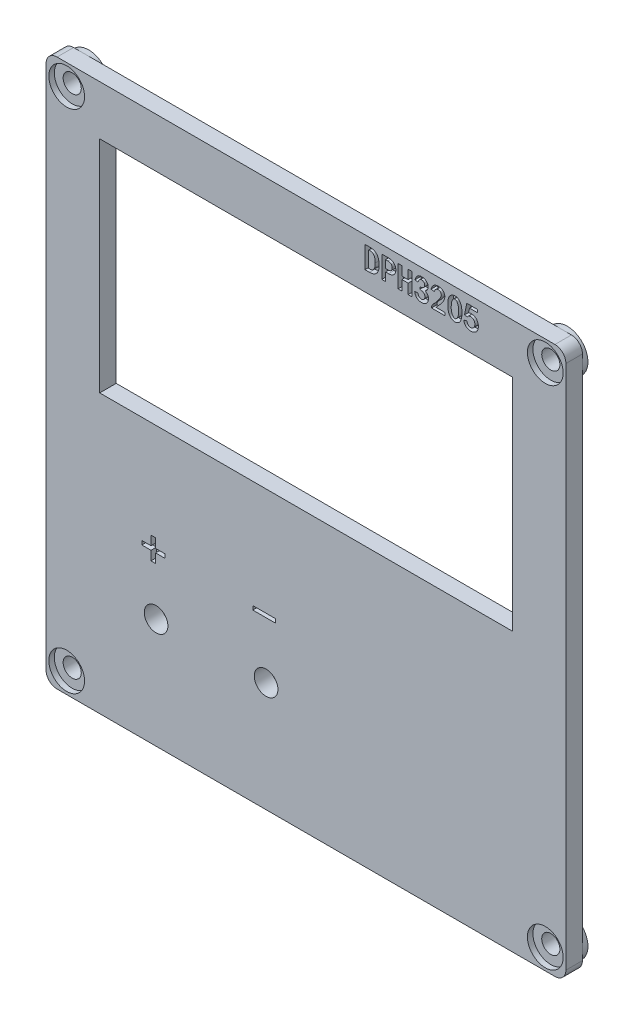
from build123d import *

# Parameters (mm, degrees)
SKETCH_1_R          = 2.15
SKETCH_1_W          = 75
SKETCH_1_H          = 40
EXTRUDE_1_DEPTH     = 3
SKETCH_2_W          = 4.137797811
SKETCH_2_H          = 0.710882164
CUT_EXTRUDE_1_DEPTH = 1
SKETCH_3_R          = 3.75
EXTRUDE_2_DEPTH     = 1
SKETCH_4_R          = 1.65
CUT_EXTRUDE_2_DEPTH = 69.72863319
SKETCH_5_R          = 3.25
CUT_EXTRUDE_3_DEPTH = 1


with BuildPart() as part:
    # 草图1 → 凸台-拉伸1 (new body)
    with BuildSketch(Plane.XY):
        with BuildLine():
            Line((-45.25, -49.75), (45.25, -49.75))
            ThreePointArc((45.25, -49.75), (46.664213562, -49.164213562), (47.25, -47.75))
            Line((47.25, -47.75), (47.25, 47.75))
            ThreePointArc((47.25, 47.75), (46.664213562, 49.164213562), (45.25, 49.75))
            Line((45.25, 49.75), (-45.25, 49.75))
            ThreePointArc((-45.25, 49.75), (-46.664213562, 49.164213562), (-47.25, 47.75))
            Line((-47.25, 47.75), (-47.25, -47.75))
            ThreePointArc((-47.25, -47.75), (-46.664213562, -49.164213562), (-45.25, -49.75))
        make_face()
        with Locations((-27.25, -29.75)):
            Circle(SKETCH_1_R, mode=Mode.SUBTRACT)
        with Locations((-7.25, -29.75)):
            Circle(SKETCH_1_R, mode=Mode.SUBTRACT)
        with Locations((0, 20.75)):
            Rectangle(SKETCH_1_W, SKETCH_1_H, mode=Mode.SUBTRACT)
    extrude(amount=EXTRUDE_1_DEPTH)

    # 草图2 → 切除-拉伸1 (cut)
    # profile 1 of 9: a face of its own
    with BuildSketch(Plane.XY.offset(3)):
        with BuildLine():
            add(Edge.make_bspline(
                [(25.773758367, 46.505328525), (25.775969709, 46.555147397), (25.78028274, 46.652314757), (25.792643094, 46.793720271), (25.807811887, 46.927506481), (25.827234123, 47.053324063), (25.851527714, 47.171241352), (25.878621466, 47.281438374), (25.910258204, 47.383865297), (25.958071695, 47.508706729), (26.028073633, 47.65355075), (26.129838409, 47.812915081), (26.249373739, 47.956068284), (26.361427404, 48.062917846), (26.459859694, 48.137856014), (26.539050196, 48.187020162), (26.623405238, 48.228229653), (26.712377362, 48.261567945), (26.805561652, 48.288572609), (26.903860095, 48.307274167), (27.006946072, 48.318309436), (27.113386993, 48.321492741), (27.220523142, 48.317648244), (27.325149694, 48.299647225), (27.426333108, 48.272415435), (27.523724912, 48.23356352), (27.617020335, 48.183418171), (27.705974966, 48.121730736), (27.791206089, 48.049115977), (27.872032503, 47.966443402), (27.946529479, 47.875359078), (28.017067085, 47.780694437), (28.077305495, 47.679174353), (28.133000891, 47.574821135), (28.179768948, 47.464746766), (28.221878796, 47.35086003), (28.253542284, 47.230979038), (28.289719702, 47.063498275), (28.319887216, 46.841890265), (28.342221295, 46.562137879), (28.348624342, 46.264320492), (28.340737918, 46.006845206), (28.326531135, 45.798207482), (28.310482089, 45.646366882), (28.288556953, 45.501864688), (28.263873867, 45.363943398), (28.230439156, 45.23364898), (28.193993631, 45.10964595), (28.152076056, 44.992861191), (28.104678237, 44.883230969), (28.05213051, 44.780496547), (27.990371895, 44.686222656), (27.921958927, 44.599748852), (27.846666976, 44.520638651), (27.763766457, 44.449935675), (27.673294119, 44.387250387), (27.575816856, 44.332224167), (27.472861073, 44.285167849), (27.36614023, 44.248577337), (27.258979427, 44.222399489), (27.152163404, 44.208670953), (27.045937061, 44.20572628), (26.940309689, 44.215496424), (26.835177704, 44.2361569), (26.731193601, 44.269237737), (26.629037036, 44.312736289), (26.531987609, 44.365043186), (26.440383588, 44.420585111), (26.356701959, 44.480730209), (26.28118794, 44.545618287), (26.211755205, 44.612929848), (26.151672362, 44.686044277), (26.097640965, 44.762044244), (26.039569231, 44.870531569), (25.976248246, 45.009582451), (25.912056748, 45.180745354), (25.85808123, 45.35509476), (25.824800149, 45.504726549), (25.802464788, 45.629516835), (25.790263573, 45.731610409), (25.779644583, 45.841503623), (25.773230384, 45.959230052), (25.768976816, 46.08460339), (25.767102405, 46.217713298), (25.769107518, 46.358830641), (25.772177634, 46.455536739), (25.773758367, 46.505328525)],
                knots=[0, 0, 0, 0, 1.155683737, 2.254060208, 3.289083543, 4.275996313, 5.203501349, 6.078654409, 6.905254226, 7.686259293, 9.175480835, 10.625362805, 12.057229327, 13.488373587, 14.203415217, 14.921281653, 15.645099004, 16.375632236, 17.120922195, 17.891035316, 18.691651653, 19.521200253, 20.357904477, 21.171386448, 21.975949703, 22.782724614, 23.595854961, 24.425642192, 25.286833663, 26.187407587, 27.101221321, 28.01267284, 28.920448357, 29.83426209, 30.752254981, 31.690137756, 32.645956503, 33.622989927, 35.660431351, 37.823041574, 40.125301952, 42.560703798, 43.790833543, 44.971618186, 46.098231705, 47.178004829, 48.217249088, 49.214075701, 50.172927633, 51.090920525, 51.980953586, 52.843803822, 53.698431003, 54.533503556, 55.370943622, 56.21918914, 57.080584939, 57.962199368, 58.839009869, 59.691678548, 60.51441043, 61.330511274, 62.149625556, 62.967853103, 63.80909348, 64.673955469, 65.537417366, 66.362178841, 67.155619074, 67.922554923, 68.668316995, 69.393591698, 70.113049857, 70.825595159, 72.241347001, 73.651946307, 75.059845092, 76.467821999, 77.201720101, 77.997292311, 78.850038385, 79.760306499, 80.729291287, 81.757490875, 82.845382708, 84, 84, 84, 84], degree=3))
        make_face()
        with BuildLine():
            add(Edge.make_bspline(
                [(26.41509771, 46.636687186), (26.410165106, 46.585487328), (26.400476242, 46.484918041), (26.392201304, 46.33572282), (26.387876527, 46.19080666), (26.392312663, 46.050219507), (26.398966837, 45.913761834), (26.414043524, 45.782047153), (26.433830158, 45.654311536), (26.458059753, 45.531807031), (26.488276758, 45.416206016), (26.521468133, 45.309323189), (26.557380799, 45.211249156), (26.59736876, 45.123027902), (26.641451804, 45.044114897), (26.688547916, 44.97459924), (26.738281787, 44.913312011), (26.792544689, 44.862927743), (26.848364897, 44.821316698), (26.905215929, 44.789259165), (26.962359574, 44.766437831), (27.019979655, 44.753170966), (27.078314302, 44.749657478), (27.136986281, 44.756149113), (27.196285597, 44.770529558), (27.254563841, 44.796176626), (27.311436858, 44.829485722), (27.366424787, 44.869793435), (27.415834334, 44.919582698), (27.46269417, 44.97568869), (27.50553198, 45.039712753), (27.544919173, 45.11091034), (27.580297618, 45.189959669), (27.622276756, 45.306268798), (27.665555628, 45.4617722), (27.703450078, 45.656969482), (27.725582549, 45.861453971), (27.731834948, 46.071718898), (27.729599297, 46.281590487), (27.722491719, 46.484800812), (27.712611199, 46.678373121), (27.697920649, 46.862437574), (27.674674905, 47.037543403), (27.634162425, 47.202873635), (27.577482221, 47.3577924), (27.517488775, 47.478120074), (27.462791153, 47.56536967), (27.419765216, 47.623154318), (27.37345661, 47.671545013), (27.325938432, 47.713322683), (27.275020824, 47.745046871), (27.221804213, 47.768627401), (27.166358108, 47.784438549), (27.108992325, 47.791110861), (27.051120902, 47.789457516), (26.994094684, 47.77906452), (26.938124506, 47.759887967), (26.883859036, 47.730891663), (26.830409045, 47.693569323), (26.77795796, 47.647879341), (26.727069625, 47.592989371), (26.677356181, 47.529473969), (26.629533656, 47.456150099), (26.587202958, 47.371127633), (26.547238137, 47.275897154), (26.514222271, 47.168769499), (26.48132146, 47.051798414), (26.456054589, 46.922991706), (26.432189797, 46.783682654), (26.42092889, 46.686836533), (26.41509771, 46.636687186)],
                knots=[0, 0, 0, 0, 1.452167118, 2.852418281, 4.218396657, 5.543984443, 6.822765002, 8.074713207, 9.284974616, 10.471920825, 11.598846593, 12.656922723, 13.631044256, 14.5458853, 15.388812111, 16.179953707, 16.914519434, 17.61197034, 18.264888641, 18.876285569, 19.449485096, 19.996394829, 20.5387489, 21.091123116, 21.657504393, 22.254856762, 22.881287043, 23.51641241, 24.173517405, 24.856351225, 25.578003657, 26.344795291, 27.151303469, 28.020468383, 29.834110771, 31.702512638, 33.62906866, 35.634339229, 37.638355807, 39.554512999, 41.375197988, 43.110520322, 44.767505055, 46.356911141, 47.906083104, 49.416608493, 50.142950543, 50.812019548, 51.446476334, 52.031067659, 52.593805832, 53.132839029, 53.670052187, 54.215287947, 54.756919201, 55.298972215, 55.845822252, 56.420500712, 57.030186539, 57.683154838, 58.380605745, 59.14033988, 59.958423015, 60.847419337, 61.818318184, 62.871135914, 64.010020701, 65.247701822, 66.574791078, 68, 68, 68, 68], degree=3))
        make_face(mode=Mode.SUBTRACT)
    # profile 2 of 9: a face of its own
    with BuildSketch(Plane.XY.offset(3)):
        with BuildLine():
            add(Edge.make_bspline(
                [(13.285241518, 46.240035544), (13.283682115, 46.155285074), (13.280668639, 45.991508663), (13.259812953, 45.754935684), (13.22273555, 45.536896219), (13.173073162, 45.336448602), (13.106910902, 45.154244072), (13.026293325, 44.99020749), (12.931485953, 44.843811701), (12.820659608, 44.716773682), (12.696286472, 44.607755406), (12.563161093, 44.51142845), (12.418082939, 44.431513034), (12.263072893, 44.364668391), (12.096315889, 44.314857921), (11.919536629, 44.27743285), (11.731770227, 44.25631633), (11.603099923, 44.25321417), (11.537226923, 44.251626014)],
                knots=[0, 0, 0, 0, 1.342144575, 2.593633054, 3.756717374, 4.841651051, 5.859627, 6.82036316, 7.730462365, 8.613865072, 9.480661094, 10.344703869, 11.211025818, 12.098326216, 13.012995588, 13.962311034, 14.956801371, 16, 16, 16, 16], degree=3))
            Line((11.537226923, 44.251626014), (10.708722952, 44.251626014))
            Line((10.708722952, 44.251626014), (10.708722952, 48.251626014))
            Line((10.708722952, 48.251626014), (11.537226923, 48.251626014))
            add(Edge.make_bspline(
                [(11.537226923, 48.251626014), (11.610260238, 48.250152136), (11.751820851, 48.247295317), (11.956676316, 48.225090944), (12.146366, 48.187602682), (12.320852916, 48.135495871), (12.480414228, 48.068439758), (12.624969787, 47.985881101), (12.753924652, 47.887279685), (12.867888749, 47.773205371), (12.967800644, 47.642938015), (13.052548693, 47.494253787), (13.12560502, 47.328943544), (13.184776317, 47.145345933), (13.229402626, 46.944031425), (13.26162354, 46.725110145), (13.281461748, 46.48852175), (13.283952355, 46.324786503), (13.285241518, 46.240035544)],
                knots=[0, 0, 0, 0, 1.139218849, 2.20815003, 3.209846182, 4.151949686, 5.044228713, 5.904257272, 6.741881979, 7.569029454, 8.412913495, 9.295104618, 10.232584117, 11.227981957, 12.299195142, 13.445861256, 14.677952907, 16, 16, 16, 16], degree=3))
        make_face()
        with BuildLine():
            add(Edge.make_bspline(
                [(12.574359354, 46.240035544), (12.573549734, 46.306164867), (12.57199564, 46.433102252), (12.559864164, 46.615622808), (12.540805925, 46.782578834), (12.512892596, 46.934201333), (12.476157586, 47.070344041), (12.4320268, 47.191100107), (12.379864709, 47.296547246), (12.318068244, 47.38635609), (12.247965414, 47.46285518), (12.171239802, 47.529860091), (12.08537177, 47.586000977), (11.991202509, 47.631481211), (11.88917519, 47.666818632), (11.779119259, 47.691264389), (11.66103836, 47.707233513), (11.579351112, 47.708978836), (11.537226923, 47.709878858)],
                knots=[0, 0, 0, 0, 1.535002912, 2.946487986, 4.244348877, 5.43397676, 6.521824758, 7.513996585, 8.414230777, 9.245329631, 10.035428857, 10.817273383, 11.604069902, 12.409274804, 13.239177928, 14.104616871, 15.02259556, 16, 16, 16, 16], degree=3))
            Line((11.537226923, 47.709878858), (11.396424175, 47.709878858))
            Line((11.396424175, 47.709878858), (11.396424175, 44.79337317))
            Line((11.396424175, 44.79337317), (11.537226923, 44.79337317))
            add(Edge.make_bspline(
                [(11.537226923, 44.79337317), (11.579344288, 44.794347045), (11.66098203, 44.796234747), (11.779335594, 44.811216162), (11.889744031, 44.834562761), (11.99159878, 44.869176125), (12.085536319, 44.913032061), (12.17094767, 44.967647772), (12.248752448, 45.031374777), (12.318834537, 45.105681961), (12.380934193, 45.193019115), (12.432859029, 45.296288209), (12.476092639, 45.41526561), (12.513071508, 45.549530777), (12.540773279, 45.700073783), (12.559878509, 45.86615988), (12.571993635, 46.047827474), (12.573548952, 46.174192627), (12.574359354, 46.240035544)],
                knots=[0, 0, 0, 0, 0.985268004, 1.909783609, 2.787259994, 3.621665962, 4.421521346, 5.207376589, 5.987676396, 6.769383106, 7.590706022, 8.48624322, 9.465232296, 10.548914331, 11.741531606, 13.043184133, 14.459342799, 16, 16, 16, 16], degree=3))
        make_face(mode=Mode.SUBTRACT)
    # profile 3 of 9: a face of its own
    with BuildSketch(Plane.XY.offset(3)):
        with BuildLine():
            add(Edge.make_bspline(
                [(16.329671653, 47.013592101), (16.328806119, 46.968605593), (16.327107643, 46.880326519), (16.310133088, 46.751375346), (16.284075298, 46.628724295), (16.246005839, 46.513164938), (16.197560034, 46.404236552), (16.139240793, 46.301371071), (16.06887224, 46.205508952), (15.988432171, 46.116506701), (15.898521193, 46.035598708), (15.798916655, 45.965374644), (15.68972746, 45.906889173), (15.571635008, 45.858986945), (15.444923381, 45.8209571), (15.309138478, 45.794921736), (15.164754445, 45.778066366), (15.065358552, 45.77640862), (15.01436794, 45.775558188)],
                knots=[0, 0, 0, 0, 1.055941234, 2.072121589, 3.048957332, 3.996857081, 4.923552649, 5.844699312, 6.768221172, 7.710385292, 8.657546142, 9.602916946, 10.565193964, 11.559900134, 12.591170482, 13.666713964, 14.803012066, 16, 16, 16, 16], degree=3))
            Line((15.01436794, 45.775558188), (14.464035251, 45.775558188))
            Line((14.464035251, 45.775558188), (14.464035251, 44.251626014))
            Line((14.464035251, 44.251626014), (13.776334027, 44.251626014))
            Line((13.776334027, 44.251626014), (13.776334027, 48.251626014))
            Line((13.776334027, 48.251626014), (15.01436794, 48.251626014))
            add(Edge.make_bspline(
                [(15.01436794, 48.251626014), (15.065358459, 48.250775176), (15.164754169, 48.24911664), (15.309139492, 48.232266867), (15.444919861, 48.206211821), (15.571393321, 48.16832709), (15.689323223, 48.120264803), (15.797824013, 48.060813767), (15.897699579, 47.990787048), (15.987547151, 47.909793342), (16.068081752, 47.820858618), (16.138225908, 47.724699681), (16.197735386, 47.622354254), (16.245939904, 47.513123531), (16.284100665, 47.397612587), (16.310039712, 47.275221892), (16.327161825, 47.146580039), (16.3288226, 47.058580774), (16.329671653, 47.013592101)],
                knots=[0, 0, 0, 0, 1.197461093, 2.334208364, 3.410176999, 4.441854999, 5.43073401, 6.396602736, 7.342347237, 8.289882492, 9.232419041, 10.156305961, 11.081170954, 12.008232837, 12.956507283, 13.93372916, 14.943641362, 16, 16, 16, 16], degree=3))
        make_face()
        with BuildLine():
            add(Edge.make_bspline(
                [(15.64197043, 47.013592101), (15.64167773, 47.045959339), (15.641114234, 47.108271506), (15.631250111, 47.197481465), (15.616825916, 47.278714862), (15.597665845, 47.352440408), (15.571114529, 47.417980744), (15.538387259, 47.475120916), (15.50023693, 47.524371351), (15.455388593, 47.565178288), (15.40481494, 47.600096416), (15.347417164, 47.628677232), (15.284866641, 47.654842386), (15.215494445, 47.675363293), (15.139850619, 47.690364977), (15.058129368, 47.701417981), (14.970127036, 47.708352746), (14.909351534, 47.709357961), (14.877857959, 47.709878858)],
                knots=[0, 0, 0, 0, 1.287087184, 2.477851002, 3.56551051, 4.568137571, 5.502703185, 6.369845782, 7.180743627, 7.970419851, 8.772637866, 9.617977299, 10.516617182, 11.467615524, 12.490341929, 13.582105939, 14.747058877, 16, 16, 16, 16], degree=3))
            Line((14.877857959, 47.709878858), (14.464035251, 47.709878858))
            Line((14.464035251, 47.709878858), (14.464035251, 46.318163897))
            Line((14.464035251, 46.318163897), (14.877857959, 46.318163897))
            add(Edge.make_bspline(
                [(14.877857959, 46.318163897), (14.909350441, 46.318695819), (14.970409155, 46.319727126), (15.058709899, 46.3265609), (15.140696737, 46.337710851), (15.21639406, 46.352580653), (15.285484277, 46.373499153), (15.348313312, 46.398061846), (15.40494137, 46.427407508), (15.455410119, 46.461960691), (15.500231043, 46.502825219), (15.538388973, 46.552059685), (15.571114017, 46.609204533), (15.597665998, 46.674743473), (15.61682587, 46.748469436), (15.631250125, 46.829702708), (15.64111423, 46.918912704), (15.641677728, 46.981224866), (15.64197043, 47.013592101)],
                knots=[0, 0, 0, 0, 1.253177668, 2.4297043, 3.521674426, 4.544593913, 5.495771796, 6.390314524, 7.225705931, 8.028075398, 8.817900706, 9.628951643, 10.496257949, 11.431000001, 12.433816351, 13.5216812, 14.712669824, 16, 16, 16, 16], degree=3))
        make_face(mode=Mode.SUBTRACT)
    # profile 4 of 9: a face of its own
    with BuildSketch(Plane.XY.offset(3)):
        Polygon((19.260772748, 44.251626014), (18.573071524, 44.251626014), (18.573071524, 46.07175909), (17.440639672, 46.07175909), (17.440639672, 44.251626014), (16.752938449, 44.251626014), (16.752938449, 48.251626014), (17.440639672, 48.251626014), (17.440639672, 46.613506246), (18.573071524, 46.613506246), (18.573071524, 48.251626014), (19.260772748, 48.251626014), align=None)
    # profile 5 of 9: a face of its own
    with BuildSketch(Plane.XY.offset(3)):
        with BuildLine():
            Line((19.751865257, 45.352291393), (20.303915053, 45.430419746))
            add(Edge.make_bspline(
                [(20.303915053, 45.430419746), (20.322527897, 45.376460329), (20.357887277, 45.273952002), (20.426144056, 45.133940589), (20.503365858, 45.015634424), (20.575355936, 44.931661448), (20.638782126, 44.877911171), (20.687663423, 44.84326029), (20.739493325, 44.814707903), (20.794065521, 44.792432205), (20.851246549, 44.775092948), (20.911027357, 44.763102805), (20.973732907, 44.757073049), (21.037815362, 44.75726895), (21.102064811, 44.762785539), (21.164109097, 44.776071041), (21.223704826, 44.794546264), (21.279697156, 44.820709477), (21.33275333, 44.852822425), (21.382775849, 44.891533337), (21.429027941, 44.937652945), (21.472498497, 44.988700856), (21.51171804, 45.044064122), (21.54541632, 45.102277643), (21.572000201, 45.163263993), (21.593649768, 45.2257636), (21.60910437, 45.290469168), (21.618573836, 45.356861999), (21.621930306, 45.425250114), (21.619382033, 45.49476754), (21.610881373, 45.563391392), (21.597247592, 45.628923734), (21.578360894, 45.690593788), (21.553549558, 45.74831901), (21.522212256, 45.802064303), (21.485296973, 45.851831342), (21.4429354, 45.897532753), (21.394923886, 45.939749217), (21.338639819, 45.977614843), (21.274167091, 46.014175221), (21.198779264, 46.045817155), (21.114860117, 46.077189382), (21.020825599, 46.104085407), (20.917696519, 46.128905767), (20.804852417, 46.151317002), (20.72608998, 46.163365679), (20.685112735, 46.16963417)],
                knots=[0, 0, 0, 0, 2.21924101, 4.215958907, 6.040992817, 7.7053072, 8.495104242, 9.27040691, 10.032811151, 10.791629887, 11.559461714, 12.354265444, 13.159682002, 14.005854253, 14.844521828, 15.663370554, 16.46971005, 17.266772081, 18.061107775, 18.878441235, 19.720869505, 20.597620065, 21.484212586, 22.356995289, 23.209370964, 24.068482601, 24.927233434, 25.793243368, 26.673943911, 27.587530034, 28.496218265, 29.360938961, 30.188521517, 31.001368487, 31.799596098, 32.603472073, 33.407116705, 34.21988742, 35.084608115, 36.041665591, 37.098677481, 38.261085067, 39.525891865, 40.900414571, 42.387397877, 44, 44, 44, 44], degree=3))
            Line((20.685112735, 46.16963417), (20.685112735, 46.562851599))
            add(Edge.make_bspline(
                [(20.685112735, 46.562851599), (20.725812533, 46.566951134), (20.804345719, 46.574861483), (20.916916171, 46.594044211), (21.020171393, 46.616955759), (21.113855562, 46.644024174), (21.197941264, 46.676026146), (21.272699478, 46.711579511), (21.338296413, 46.751930391), (21.393327612, 46.798257558), (21.441591196, 46.847206094), (21.480534653, 46.901225645), (21.515224357, 46.957060153), (21.540391325, 47.017565156), (21.559798937, 47.08106698), (21.571489359, 47.147955425), (21.576667948, 47.218421336), (21.57470773, 47.290830965), (21.566948359, 47.362948577), (21.55007106, 47.430948714), (21.528284025, 47.494545431), (21.497753116, 47.55240176), (21.460574356, 47.605243257), (21.416324173, 47.653163772), (21.364425562, 47.694916823), (21.307089514, 47.731659985), (21.246309478, 47.762096153), (21.183795552, 47.785397606), (21.121233185, 47.802352932), (21.057641364, 47.809699831), (20.994085545, 47.810520265), (20.92965385, 47.804959816), (20.865475333, 47.789427564), (20.800038032, 47.768838572), (20.735804957, 47.735465955), (20.67276126, 47.689076343), (20.613477454, 47.627298757), (20.555378599, 47.552476926), (20.500361872, 47.463653434), (20.445795024, 47.361451425), (20.393945616, 47.245129984), (20.362965719, 47.161736455), (20.34684272, 47.118335608)],
                knots=[0, 0, 0, 0, 1.544655138, 2.980523068, 4.310085624, 5.538041238, 6.660247671, 7.704521267, 8.661264608, 9.559490368, 10.415691744, 11.250192615, 12.06957472, 12.892798034, 13.716943409, 14.573554092, 15.451518492, 16.381382685, 17.306522728, 18.184819779, 19.022465106, 19.839562419, 20.646298093, 21.457079029, 22.294445327, 23.155002605, 24.02514668, 24.85635064, 25.671730158, 26.466794538, 27.266766995, 28.070237254, 28.901511498, 29.756073687, 30.655274543, 31.621678213, 32.699429876, 33.87785843, 35.19439462, 36.640317884, 38.251506453, 40, 40, 40, 40], degree=3))
            Line((20.34684272, 47.118335608), (19.797368584, 47.196463962))
            add(Edge.make_bspline(
                [(19.797368584, 47.196463962), (19.809239482, 47.235816237), (19.832566992, 47.313147415), (19.874227902, 47.424250762), (19.917812171, 47.529602096), (19.965103325, 47.628469239), (20.015638403, 47.721458083), (20.06997827, 47.808003584), (20.126165903, 47.889441874), (20.187759361, 47.963403573), (20.252665616, 48.03205765), (20.324427508, 48.092427734), (20.402334197, 48.144965642), (20.485631487, 48.190512521), (20.574717933, 48.228616914), (20.669755236, 48.258331904), (20.770432139, 48.281800881), (20.875918338, 48.296474854), (20.982580733, 48.3051184), (21.087809443, 48.30663585), (21.190210064, 48.302706107), (21.28977884, 48.291550541), (21.386256282, 48.273662), (21.479338715, 48.248344895), (21.569889341, 48.217593356), (21.656949772, 48.180117772), (21.738895303, 48.136477806), (21.815187368, 48.088252857), (21.884655518, 48.035034111), (21.947965698, 47.977345495), (22.004028953, 47.914312176), (22.053320914, 47.846180064), (22.095135635, 47.772753509), (22.131419489, 47.695640996), (22.16003099, 47.61527674), (22.183194708, 47.533088783), (22.196972044, 47.448684641), (22.206256304, 47.362969551), (22.206607991, 47.275344026), (22.200743541, 47.186370711), (22.18739375, 47.095487764), (22.168388673, 47.00362617), (22.140317229, 46.912388801), (22.101650354, 46.824222569), (22.051284759, 46.740649056), (21.990529759, 46.661189674), (21.91963906, 46.585446861), (21.838673163, 46.513276581), (21.747011889, 46.444900285), (21.680250055, 46.4043288), (21.64583392, 46.383413951)],
                knots=[0, 0, 0, 0, 1.264664845, 2.485193632, 3.649815651, 4.772554787, 5.8564488, 6.904873161, 7.916470085, 8.89869285, 9.86418825, 10.820480558, 11.778069864, 12.751606364, 13.738084608, 14.754768136, 15.81232734, 16.915902724, 18.029136064, 19.103794268, 20.152810375, 21.180875043, 22.184503936, 23.16940822, 24.147039655, 25.125424593, 26.08285187, 27.001536872, 27.899944066, 28.772641487, 29.633525806, 30.491521848, 31.355643938, 32.230383382, 33.110780052, 33.97826197, 34.85428633, 35.739428161, 36.629028292, 37.54707979, 38.481255219, 39.453795203, 40.431585318, 41.413492129, 42.408894417, 43.427064688, 44.486456052, 45.596758908, 46.761114469, 48, 48, 48, 48], degree=3))
            add(Edge.make_bspline(
                [(21.64583392, 46.383413951), (21.670582827, 46.373146404), (21.719451451, 46.35287234), (21.789976856, 46.317014014), (21.854754808, 46.273243025), (21.917436744, 46.226205881), (21.975254215, 46.17283043), (22.030409082, 46.114814186), (22.080301223, 46.0505461), (22.127019597, 45.981749988), (22.168673238, 45.908150229), (22.202109327, 45.828216535), (22.228647467, 45.743451125), (22.247638347, 45.653467999), (22.258328344, 45.558620934), (22.262858503, 45.458767222), (22.25877886, 45.353801374), (22.248986298, 45.245310861), (22.231005052, 45.136385427), (22.201194171, 45.03105872), (22.162946892, 44.930041543), (22.113263088, 44.834330754), (22.054854888, 44.743065268), (21.98667074, 44.656522955), (21.907725487, 44.575952013), (21.821162666, 44.499852774), (21.72707686, 44.432280678), (21.630380815, 44.371548198), (21.529744081, 44.321247441), (21.425867751, 44.281169371), (21.31913788, 44.249699544), (21.209167193, 44.22965671), (21.09640518, 44.2169563), (20.981497081, 44.216051105), (20.867247772, 44.222434116), (20.756239223, 44.2381919), (20.649251722, 44.260968087), (20.546902545, 44.293148588), (20.448368539, 44.332387319), (20.354600439, 44.38120836), (20.264070949, 44.436524635), (20.178982958, 44.501542883), (20.098276542, 44.574106071), (20.026465517, 44.65802394), (19.961630749, 44.750692786), (19.904001004, 44.852378721), (19.853959626, 44.9638923), (19.812722177, 45.085154851), (19.77675534, 45.215171784), (19.76030962, 45.305771351), (19.751865257, 45.352291393)],
                knots=[0, 0, 0, 0, 0.768138437, 1.516748496, 2.263152186, 3.006528408, 3.761540595, 4.516106847, 5.299044825, 6.090959292, 6.899030075, 7.718886061, 8.570043758, 9.442217001, 10.351016586, 11.303647327, 12.305160512, 13.359969178, 14.42557193, 15.464691966, 16.493198161, 17.516980995, 18.550254108, 19.59586457, 20.669303552, 21.779974798, 22.895936785, 23.986546903, 25.050632422, 26.115666464, 27.175060169, 28.23550182, 29.31644003, 30.424198195, 31.525587691, 32.594249943, 33.6354733, 34.657940217, 35.666553097, 36.671990709, 37.685198356, 38.704235937, 39.737964997, 40.790761429, 41.862851258, 42.976186133, 44.136653187, 45.361383937, 46.645153232, 48, 48, 48, 48], degree=3))
        make_face()
    # profile 6 of 9: a face of its own
    with BuildSketch(Plane.XY.offset(3)):
        with BuildLine():
            add(Edge.make_bspline(
                [(22.819476332, 44.423336681), (22.822214596, 44.453206146), (22.82768775, 44.512908261), (22.848307906, 44.60012257), (22.875620948, 44.685491813), (22.912698547, 44.767712356), (22.958646447, 44.847222256), (23.013108507, 44.923825472), (23.075923691, 44.998043266), (23.1489916, 45.069181292), (23.228255981, 45.143518527), (23.31093372, 45.227492165), (23.397949564, 45.320796087), (23.489769179, 45.423035901), (23.586392017, 45.534238171), (23.68714147, 45.654978067), (23.792926502, 45.785003072), (23.901180239, 45.920670206), (24.006603986, 46.057129952), (24.104204284, 46.188428094), (24.192990531, 46.310583868), (24.270506003, 46.425355104), (24.338268838, 46.531622594), (24.396957347, 46.629224789), (24.445440054, 46.718449284), (24.494689949, 46.823686839), (24.540304453, 46.944657022), (24.578130085, 47.080422898), (24.593895422, 47.204917282), (24.588615055, 47.318209287), (24.562715796, 47.420133148), (24.522585294, 47.51363447), (24.462488763, 47.595746412), (24.389061934, 47.667393581), (24.305512395, 47.725504742), (24.214292043, 47.765494672), (24.117943114, 47.784708338), (24.018303963, 47.782931083), (23.918081324, 47.764343267), (23.818007454, 47.731349927), (23.719570869, 47.682286952), (23.63958032, 47.630038284), (23.576841643, 47.579774072), (23.532247319, 47.533217894), (23.488555493, 47.481285838), (23.446984623, 47.422082699), (23.407758741, 47.355891167), (23.370309713, 47.282906712), (23.333720016, 47.203451231), (23.312245733, 47.147375689), (23.301124755, 47.118335608)],
                knots=[0, 0, 0, 0, 0.812458924, 1.623916483, 2.423975288, 3.240316732, 4.06429525, 4.910522612, 5.785959881, 6.696898735, 7.673935193, 8.733053017, 9.891570135, 11.133511023, 12.459304827, 13.886182053, 15.39761038, 17.004732369, 18.59270287, 20.073435524, 21.441110431, 22.687384008, 23.828405559, 24.858552289, 25.775225142, 26.580685755, 28.007647397, 29.276407073, 30.393989518, 31.396581679, 32.332049695, 33.231912994, 34.138577372, 35.071531117, 36.003612958, 36.883031381, 37.753604976, 38.646109437, 39.568611226, 40.508543129, 41.494232884, 42.542490605, 43.093985918, 43.670208311, 44.28726261, 44.933214355, 45.629294362, 46.372086978, 47.156945713, 48, 48, 48, 48], degree=3))
            Line((23.301124755, 47.118335608), (22.728469679, 47.196463962))
            add(Edge.make_bspline(
                [(22.728469679, 47.196463962), (22.744267635, 47.24501027), (22.774819914, 47.338895852), (22.827688554, 47.472579161), (22.883368928, 47.595600866), (22.941974509, 47.708162807), (23.004996168, 47.808867792), (23.070267618, 47.899309233), (23.139733681, 47.978177759), (23.212402866, 48.046993333), (23.28934976, 48.105687848), (23.368572037, 48.1581106), (23.45172664, 48.202892171), (23.537644554, 48.241143476), (23.627623986, 48.27069012), (23.720336031, 48.295269822), (23.81693379, 48.31153556), (23.882599463, 48.316790776), (23.915848944, 48.319451728)],
                knots=[0, 0, 0, 0, 1.394098335, 2.696100676, 3.923911207, 5.081226417, 6.159164946, 7.166006065, 8.124123657, 9.025463167, 9.894746418, 10.764099952, 11.617494181, 12.471460966, 13.329175664, 14.201265779, 15.089220005, 16, 16, 16, 16], degree=3))
            add(Edge.make_bspline(
                [(23.915848944, 48.319451728), (23.955029812, 48.322567863), (24.032165767, 48.328702646), (24.146372835, 48.328482018), (24.256537562, 48.320858676), (24.363850632, 48.305674995), (24.469590993, 48.279810774), (24.575385014, 48.241334879), (24.681747204, 48.19045509), (24.787915144, 48.12737247), (24.890206836, 48.050977966), (24.982992956, 47.958123294), (25.063702295, 47.849618641), (25.133466532, 47.727888309), (25.188291159, 47.592281861), (25.222643798, 47.443447676), (25.234267923, 47.28247802), (25.228922987, 47.141237571), (25.212633071, 47.021638534), (25.189504439, 46.926257623), (25.158723716, 46.826275854), (25.117494582, 46.722334398), (25.069094214, 46.613312018), (25.009676541, 46.500777491), (24.94304756, 46.38297191), (24.865067812, 46.259465102), (24.774569565, 46.125693415), (24.665414279, 45.980477865), (24.54019287, 45.818470559), (24.395679697, 45.642519784), (24.234379876, 45.450441459), (24.053401904, 45.245160165), (23.856404999, 45.02298362), (23.716935969, 44.871828557), (23.64454609, 44.79337317)],
                knots=[0, 0, 0, 0, 0.767290437, 1.510576088, 2.227684762, 2.922405895, 3.624527997, 4.349326193, 5.116759085, 5.923767319, 6.757595258, 7.603269073, 8.477329005, 9.390943466, 10.336361207, 11.323254094, 12.360540583, 13.479157188, 14.077452175, 14.714578673, 15.39335949, 16.11880377, 16.896766127, 17.721631154, 18.602666877, 19.539239205, 20.57313278, 21.755702502, 23.085980454, 24.571542942, 26.201589399, 27.983822824, 29.915447008, 32, 32, 32, 32], degree=3))
            Line((23.64454609, 44.79337317), (25.282665858, 44.79337317))
            Line((25.282665858, 44.79337317), (25.282665858, 44.273948401))
            Line((25.282665858, 44.273948401), (22.819476332, 44.273948401))
            Line((22.819476332, 44.273948401), (22.819476332, 44.423336681))
        make_face()
    # profile 7 of 9: a face of its own
    with BuildSketch(Plane.XY.offset(3)):
        with BuildLine():
            add(Edge.make_bspline(
                [(29.233728318, 45.453600687), (29.247737974, 45.403799456), (29.274392587, 45.309048205), (29.3259343, 45.178368857), (29.379308591, 45.063812115), (29.441380905, 44.968640726), (29.505642517, 44.888829296), (29.577499914, 44.828321231), (29.6540715, 44.784380232), (29.735967471, 44.761465325), (29.81697717, 44.750906579), (29.895263673, 44.743952855), (29.970202751, 44.74543559), (30.041803702, 44.750782977), (30.109881953, 44.763429234), (30.173835929, 44.784085766), (30.235261117, 44.808051938), (30.30986516, 44.851276054), (30.395285328, 44.91275894), (30.483887248, 44.999105248), (30.556248548, 45.097002441), (30.61298615, 45.205178311), (30.654775792, 45.322070368), (30.68206031, 45.446466342), (30.696584938, 45.577114035), (30.697274408, 45.711768991), (30.684618711, 45.844499933), (30.655446259, 45.969353784), (30.611181702, 46.083490766), (30.549299937, 46.183992703), (30.476952789, 46.271636681), (30.394156154, 46.344350295), (30.301845808, 46.401035702), (30.200899547, 46.440990055), (30.093587734, 46.466314256), (29.980979952, 46.474415716), (29.864163837, 46.467076208), (29.765186755, 46.44890354), (29.685285536, 46.425659577), (29.626214009, 46.40042891), (29.568051509, 46.369291731), (29.511607679, 46.331382754), (29.456542318, 46.287383631), (29.402979213, 46.237313436), (29.351292688, 46.180232461), (29.319024531, 46.138662842), (29.302412585, 46.117262416)],
                knots=[0, 0, 0, 0, 1.537192631, 2.924645138, 4.172950761, 5.287034592, 6.295929931, 7.20786789, 8.064956688, 8.899573886, 9.716699463, 10.493344004, 11.233712164, 11.942501119, 12.62675559, 13.286166759, 13.938789652, 14.58264386, 15.843904776, 17.059411739, 18.245643967, 19.448485466, 20.678589279, 21.925530999, 23.227026748, 24.580050769, 25.922948891, 27.181997545, 28.381342405, 29.545920675, 30.675752054, 31.749220963, 32.807301153, 33.880230292, 34.963870352, 36.073362554, 37.224149094, 38.435837451, 39.057723884, 39.694624026, 40.341843349, 41.016828394, 41.713198217, 42.435647197, 43.194656643, 44, 44, 44, 44], degree=3))
            Line((29.302412585, 46.117262416), (28.795866116, 46.170492723))
            add(Edge.make_bspline(
                [(28.795866116, 46.170492723), (28.798125835, 46.180802212), (28.803595933, 46.20575837), (28.81413302, 46.249424006), (28.827198349, 46.306277089), (28.841167917, 46.37664882), (28.859368623, 46.459895439), (28.881282914, 46.555829061), (28.903836843, 46.665126155), (28.93078977, 46.786905185), (28.960337489, 46.921848886), (28.990254789, 47.070485738), (29.026443272, 47.231499204), (29.062856422, 47.405955518), (29.10238229, 47.593459782), (29.145307035, 47.793728882), (29.190992629, 48.007183609), (29.222023367, 48.153744837), (29.238021084, 48.229303627)],
                knots=[0, 0, 0, 0, 0.24057108, 0.582349894, 1.023873684, 1.570166996, 2.217595892, 2.966196822, 3.813184297, 4.761323978, 5.809238588, 6.961962194, 8.217186954, 9.57081982, 11.02423553, 12.585169261, 14.239503842, 16, 16, 16, 16], degree=3))
            Line((29.238021084, 48.229303627), (31.190371374, 48.229303627))
            Line((31.190371374, 48.229303627), (31.190371374, 47.709878858))
            Line((31.190371374, 47.709878858), (29.722245167, 47.709878858))
            add(Edge.make_bspline(
                [(29.722245167, 47.709878858), (29.713496917, 47.663778964), (29.696523745, 47.574336903), (29.669764064, 47.444426455), (29.64338084, 47.323023904), (29.616928831, 47.209842632), (29.589239038, 47.10585611), (29.562919334, 47.009716668), (29.535600941, 46.922410468), (29.516063153, 46.867298275), (29.506748279, 46.84102288)],
                knots=[0, 0, 0, 0, 1.256676802, 2.438178378, 3.552193711, 4.58399454, 5.550714312, 6.434047499, 7.253413474, 8, 8, 8, 8], degree=3))
            add(Edge.make_bspline(
                [(29.506748279, 46.84102288), (29.525425911, 46.853667805), (29.562667954, 46.878881004), (29.622494339, 46.910740493), (29.68542272, 46.937395755), (29.751422259, 46.958974948), (29.820767568, 46.974295591), (29.893096616, 46.984500227), (29.968852494, 46.989859306), (30.073953288, 46.988027074), (30.206300931, 46.975554643), (30.364247053, 46.946949429), (30.518776929, 46.899478099), (30.66855636, 46.839856401), (30.80786813, 46.768326723), (30.927263139, 46.681435049), (31.02815913, 46.585384413), (31.102409012, 46.474920898), (31.162285736, 46.361817607), (31.215219156, 46.250133106), (31.257236517, 46.138524615), (31.291298175, 46.027670776), (31.316873463, 45.914974149), (31.331527897, 45.798537366), (31.33990855, 45.678092376), (31.33739026, 45.553869193), (31.328077059, 45.426843841), (31.30547124, 45.298219988), (31.274934251, 45.167846842), (31.234200046, 45.037540442), (31.18319785, 44.910880337), (31.117240258, 44.792870092), (31.037920872, 44.684998707), (30.945111327, 44.587561607), (30.840686761, 44.499739643), (30.724706865, 44.421501252), (30.597855179, 44.35163537), (30.45992171, 44.291543085), (30.311208106, 44.24388231), (30.15189915, 44.21293323), (29.982937169, 44.199910122), (29.836936416, 44.202245221), (29.717825351, 44.214568603), (29.628514963, 44.229869305), (29.540204706, 44.252073378), (29.454091007, 44.282849848), (29.368235884, 44.317436892), (29.284813143, 44.361048607), (29.202600149, 44.411185174), (29.1205025, 44.466174047), (29.042033377, 44.531413157), (28.972001413, 44.610688474), (28.907380647, 44.700475039), (28.848652454, 44.80193692), (28.796646839, 44.915274705), (28.751465736, 45.04064852), (28.711543302, 45.177323567), (28.691855692, 45.273423416), (28.681678522, 45.323100579)],
                knots=[0, 0, 0, 0, 0.558703968, 1.114021137, 1.676538828, 2.250740009, 2.832340435, 3.434174978, 4.059780627, 4.71234648, 6.037085189, 7.350286386, 8.683183468, 10.035824363, 11.342978111, 12.55173532, 13.685234759, 14.775295779, 15.832130109, 16.857066489, 17.835806051, 18.784875571, 19.729588613, 20.695575239, 21.690601273, 22.719138875, 23.77230156, 24.843884448, 25.951797749, 27.089129695, 28.224513774, 29.329517252, 30.430347232, 31.534120828, 32.65658214, 33.805444367, 34.995875528, 36.241061519, 37.528613975, 38.85841261, 40.253203749, 41.721664277, 42.470472116, 43.219078383, 43.965665933, 44.72382088, 45.483831453, 46.257844909, 47.053365058, 47.869794771, 48.705288143, 49.574106249, 50.483548187, 51.44336999, 52.474740496, 53.569728423, 54.743712936, 56, 56, 56, 56], degree=3))
            Line((28.681678522, 45.323100579), (29.233728318, 45.453600687))
        make_face()
    # profile 8 of 9: a face of its own
    with BuildSketch(Plane.XY.offset(3)):
        Polygon((-25.674922818, -19.361696327), (-27.346526166, -19.361696327), (-27.346526166, -21.034587505), (-28.17460086, -21.034587505), (-28.17460086, -19.361696327), (-29.846204209, -19.361696327), (-29.846204209, -18.650814163), (-28.17460086, -18.650814163), (-28.17460086, -16.979210815), (-27.346526166, -16.979210815), (-27.346526166, -18.650814163), (-25.674922818, -18.650814163), align=None)
    # profile 9 of 9: a face of its own
    with BuildSketch(Plane.XY.offset(3)):
        with Locations((-7.600800521, -19.167667283)):
            Rectangle(SKETCH_2_W, SKETCH_2_H)
    extrude(amount=-CUT_EXTRUDE_1_DEPTH, mode=Mode.SUBTRACT)

    # 草图3 → 凸台-拉伸2 (add)
    with BuildSketch(Plane(origin=(0, 0, 0), x_dir=(-1, 0, 0), z_dir=(0, 0, -1))):
        with Locations(Location((-43.5, 46, 0), (0, 0, 180))):
            Circle(SKETCH_3_R)
        with Locations((43.5, 46)):
            Circle(SKETCH_3_R)
        with Locations((43.5, -46)):
            Circle(SKETCH_3_R)
        with Locations(Location((-43.5, -46, 0), (0, 0, 180))):
            Circle(SKETCH_3_R)
    extrude(amount=EXTRUDE_2_DEPTH)

    # 草图4 → 切除-拉伸2 (cut, through all)
    with BuildSketch(Plane(origin=(0, 0, -1), x_dir=(-1, 0, 0), z_dir=(0, 0, -1))):
        with Locations((-43.5, 46)):
            Circle(SKETCH_4_R)
        with Locations((43.5, 46)):
            Circle(SKETCH_4_R)
        with Locations((43.5, -46)):
            Circle(SKETCH_4_R)
        with Locations((-43.5, -46)):
            Circle(SKETCH_4_R)
    extrude(amount=-CUT_EXTRUDE_2_DEPTH, mode=Mode.SUBTRACT)

    # 草图5 → 切除-拉伸3 (cut)
    with BuildSketch(Plane.XY.offset(3)):
        with Locations((-43.5, 46)):
            Circle(SKETCH_5_R)
        with Locations((43.5, 46)):
            Circle(SKETCH_5_R)
        with Locations((43.5, -46)):
            Circle(SKETCH_5_R)
        with Locations((-43.5, -46)):
            Circle(SKETCH_5_R)
    extrude(amount=-CUT_EXTRUDE_3_DEPTH, mode=Mode.SUBTRACT)


solid = part.part
